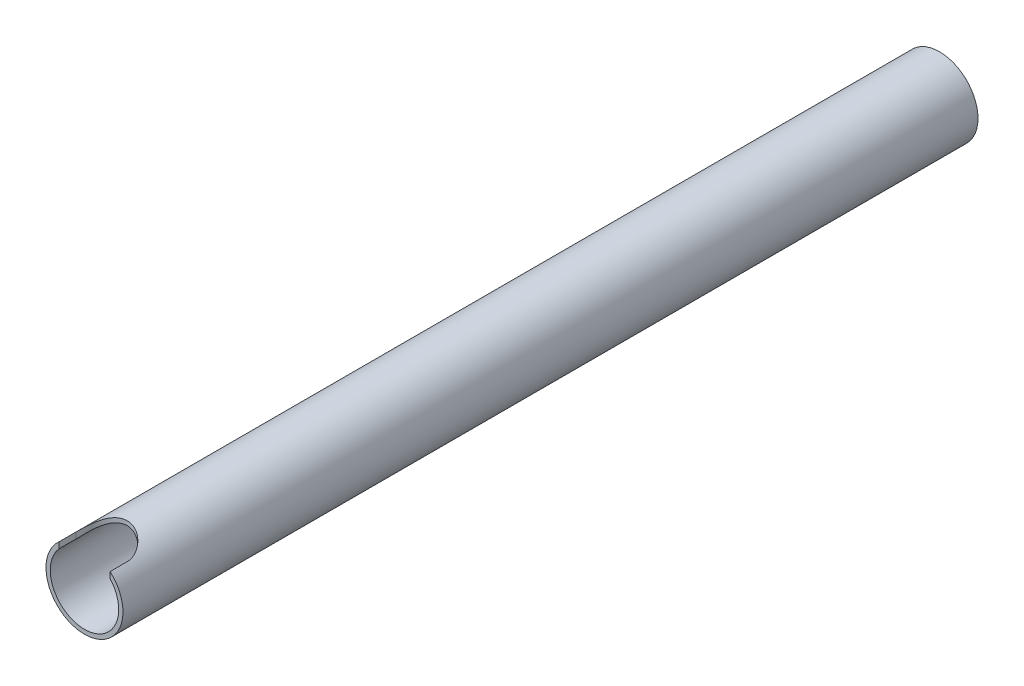
from build123d import *

# Parameters (mm, degrees)
SKETCH1_R           = 9
SKETCH1_R_2         = 8
BOSS_EXTRUDE1_DEPTH = 200
CUT_EXTRUDE1_DEPTH  = 10


with BuildPart() as part:
    # Sketch1 → Boss-Extrude1 (new body)
    with BuildSketch(Plane.XY):
        Circle(SKETCH1_R)
        Circle(SKETCH1_R_2, mode=Mode.SUBTRACT)
    extrude(amount=BOSS_EXTRUDE1_DEPTH)

    # Sketch2 → Cut-Extrude1 (cut)
    with BuildSketch(Plane(origin=(0, 10, 0), x_dir=(1, 0, 0), z_dir=(0, 1, 0))):
        with BuildLine():
            Line((-6, -204), (-6, -196))
            ThreePointArc((-6, -196), (0, -190), (6, -196))
            Line((6, -196), (6, -204))
            ThreePointArc((6, -204), (0, -210), (-6, -204))
        make_face()
    extrude(amount=-CUT_EXTRUDE1_DEPTH, mode=Mode.SUBTRACT)


solid = part.part
